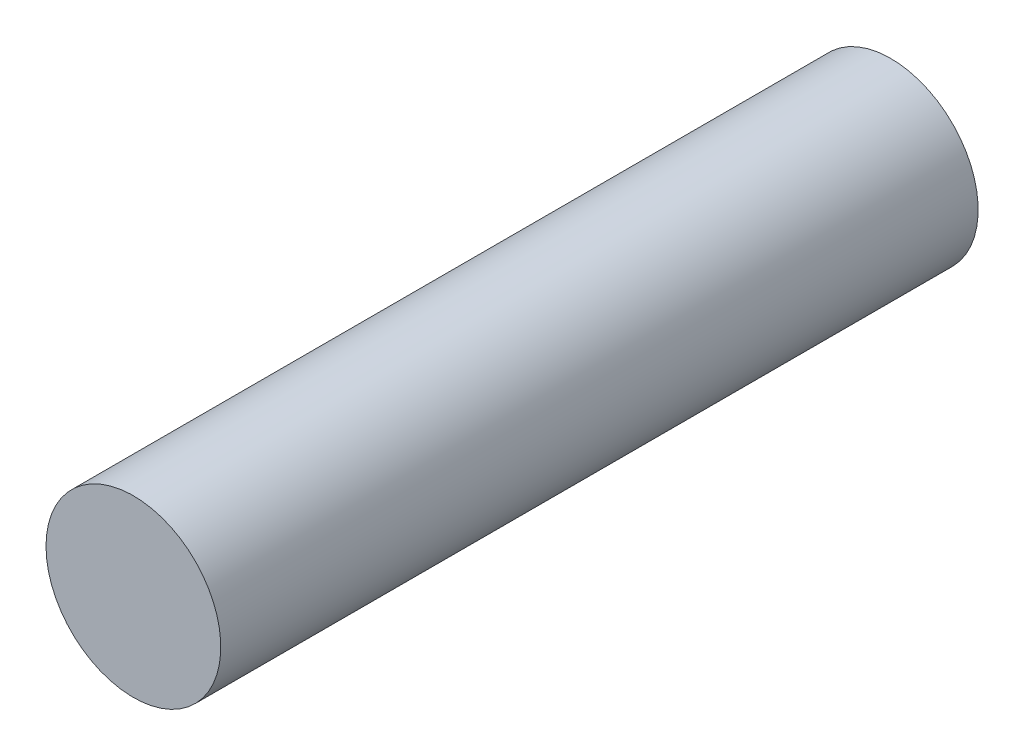
from build123d import *

# Parameters (mm, degrees)
SKETCH1_R           = 1.5
BOSS_EXTRUDE1_DEPTH = 13


with BuildPart() as part:
    # Sketch1 → Boss-Extrude1 (new body)
    with BuildSketch(Plane.XY):
        with Locations(Location((0, 0, 0), (0, 0, 180))):
            Circle(SKETCH1_R)
    extrude(amount=BOSS_EXTRUDE1_DEPTH)


solid = part.part
